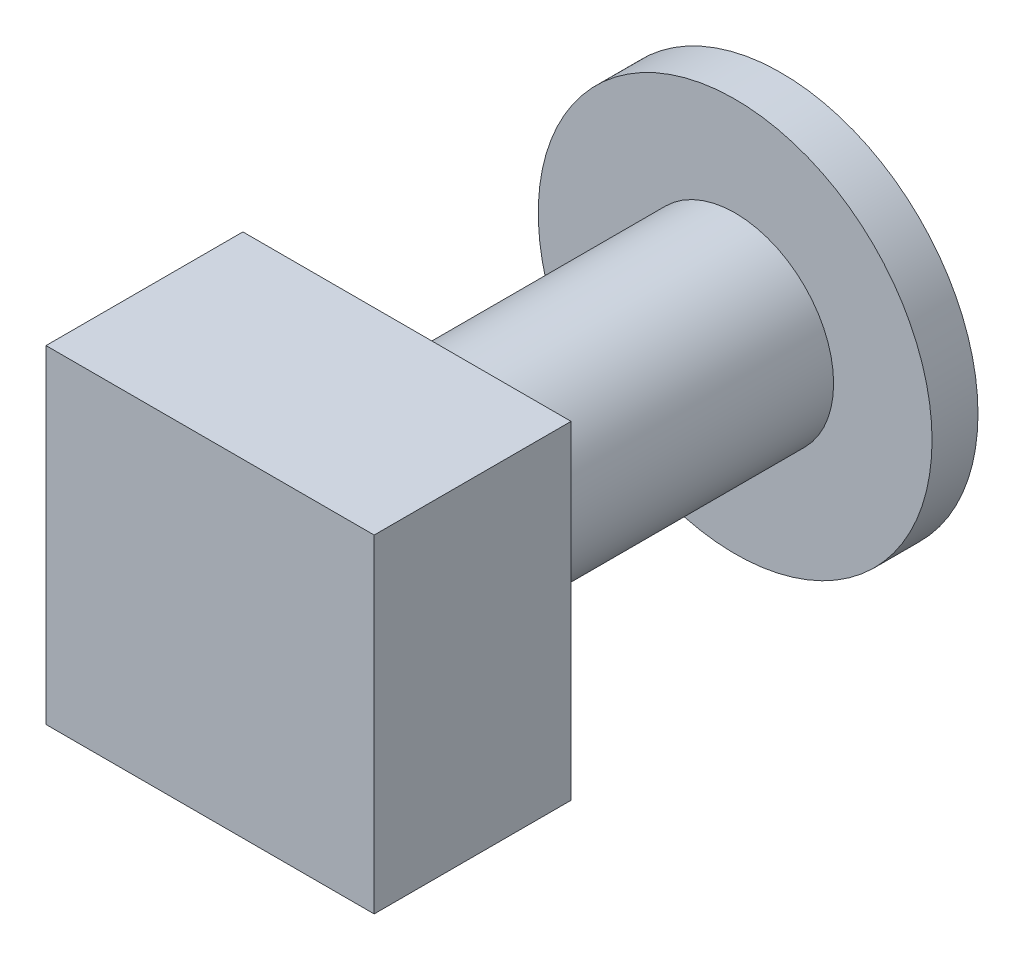
from build123d import *

# Parameters (mm, degrees)
SKETCH_1_R      = 30
EXTRUDE_1_DEPTH = 7
SKETCH_2_R      = 15
EXTRUDE_2_DEPTH = 50
SKETCH_3_W      = 50
SKETCH_3_H      = 50
EXTRUDE_3_DEPTH = 30


with BuildPart() as part:
    # 스케치1 → 보스-돌출1 (new body)
    with BuildSketch(Plane.XY):
        Circle(SKETCH_1_R)
    extrude(amount=EXTRUDE_1_DEPTH)

    # 스케치2 → 보스-돌출2 (add)
    with BuildSketch(Plane.XY.offset(7)):
        Circle(SKETCH_2_R)
    extrude(amount=EXTRUDE_2_DEPTH)

    # 스케치3 → 보스-돌출3 (add)
    with BuildSketch(Plane.XY.offset(57)):
        Rectangle(SKETCH_3_W, SKETCH_3_H)
    extrude(amount=EXTRUDE_3_DEPTH)


solid = part.part
